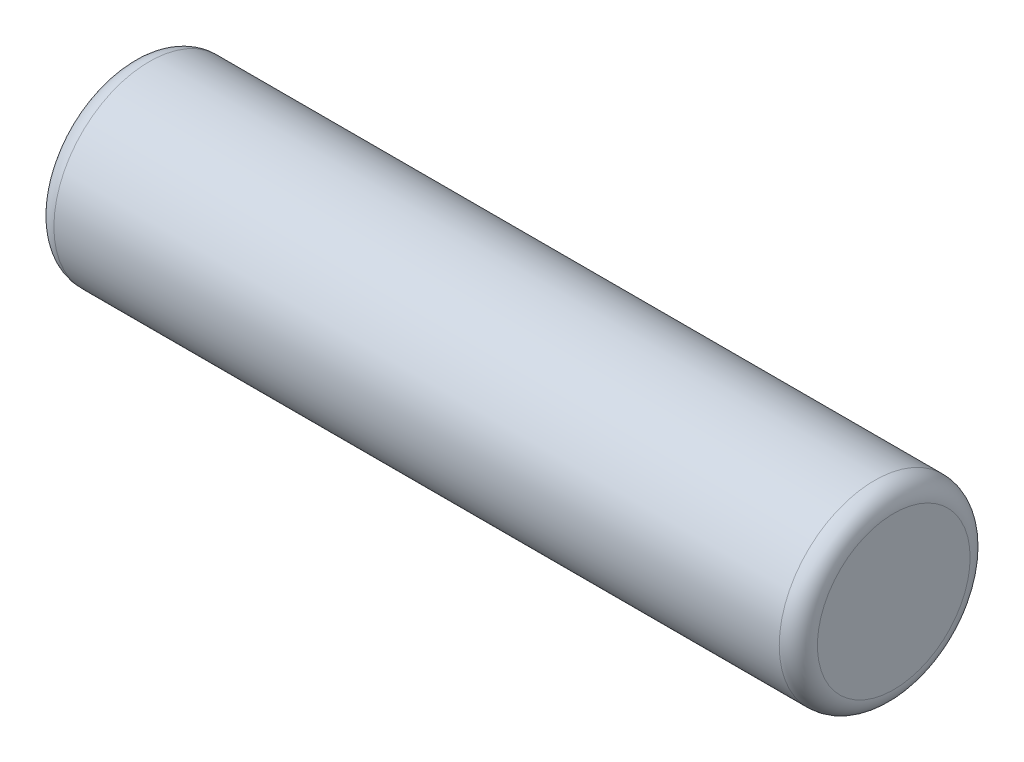
from build123d import *

# Parameters (mm, degrees)
SKETCH1_R           = 12.7
BOSS_EXTRUDE1_DEPTH = 101.6
FILLET1_R           = 2.54


with BuildPart() as part:
    # Sketch1 → Boss-Extrude1 (new body)
    with BuildSketch(Plane(origin=(0, 0, 0), x_dir=(0, 0, -1), z_dir=(1, 0, 0))):
        Circle(SKETCH1_R)
    extrude(amount=-BOSS_EXTRUDE1_DEPTH)

    # Fillet1
    fillet1_edges = [part.edges().sort_by_distance(p)[0] for p in [
        (0, 0, 12.7),
        (-101.6, 0, 12.7),
    ]]
    fillet(fillet1_edges, radius=FILLET1_R)


solid = part.part
